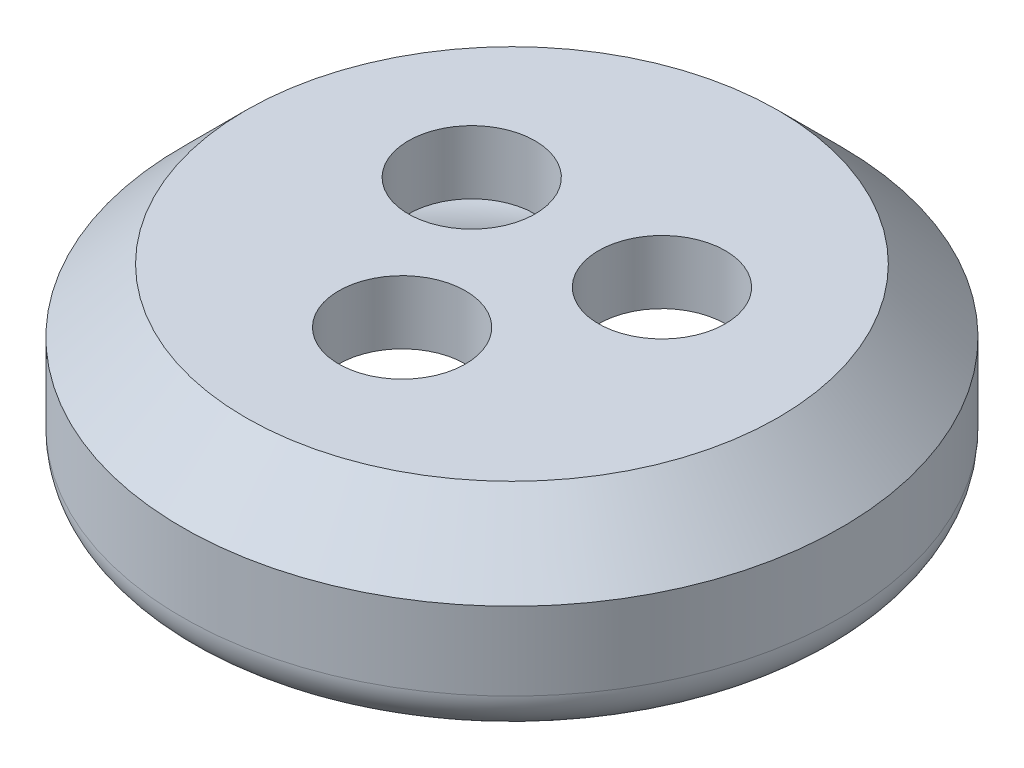
from build123d import *

# Parameters (mm, degrees)
CUT_EXTRUDE1_REACH = 24.772
SKETCH3_R          = 3


with BuildPart() as part:
    # Sketch2 → Revolve1 (revolve)
    with BuildSketch(Plane.XY, mode=Mode.PRIVATE) as revolve1_sk:
        with BuildLine():
            Line((-12.593114148, 22.177254176), (-15.593114148, 19.177254176))
            Line((-15.593114148, 19.177254176), (-15.593114148, 15.495111766))
            ThreePointArc((-15.593114148, 15.495111766), (-15.00732771, 14.080898204), (-13.593114148, 13.495111766))
            Line((-13.593114148, 13.495111766), (-12.565328021, 13.495111766))
            ThreePointArc((-12.565328021, 13.495111766), (-12.634939156, 14.785886966), (-13.41748538, 15.814754176))
            ThreePointArc((-13.41748538, 15.814754176), (-13.513613389, 15.897930793), (-13.593114148, 15.997120375))
            ThreePointArc((-13.593114148, 15.997120375), (-13.503619616, 17.46180735), (-12.915716215, 18.806309784))
            ThreePointArc((-12.915716215, 18.806309784), (-11.959555448, 19.80834635), (-10.624554433, 20.177254176))
            Line((-10.624554433, 20.177254176), (-9.75, 20.177254176))
            ThreePointArc((-9.75, 20.177254176), (-9.255025253, 19.972228922), (-9.05, 19.477254176))
            Line((-9.05, 19.477254176), (-9.05, 19.177254176))
            Line((-9.05, 19.177254176), (0, 19.177254176))
            Line((0, 19.177254176), (0, 22.177254176))
            Line((0, 22.177254176), (-12.593114148, 22.177254176))
        make_face()
    revolve(revolve1_sk.sketch.rotate(Axis((0, 0, 0), (0, 1, 0)), 270), axis=Axis((0, 0, 0), (0, 1, 0)))

    # Sketch3 → Cut-Extrude1 (cut, up to next)
    with BuildSketch(Plane.XZ.offset(-19.177254176), mode=Mode.PRIVATE) as cut_extrude1_sk1:
        with Locations(Location((-4.5, -2.598076211, 0), (0, 0, 270))):
            Circle(SKETCH3_R)
    cut_extrude1_tool1 = extrude(cut_extrude1_sk1.sketch, amount=-CUT_EXTRUDE1_REACH, mode=Mode.PRIVATE) & part.part
    # Sketch3 → Cut-Extrude1 (cut, up to next)
    with BuildSketch(Plane.XZ.offset(-19.177254176), mode=Mode.PRIVATE) as cut_extrude1_sk2:
        with Locations(Location((4.5, -2.598076211, 0), (0, 0, 270))):
            Circle(SKETCH3_R)
    cut_extrude1_tool2 = extrude(cut_extrude1_sk2.sketch, amount=-CUT_EXTRUDE1_REACH, mode=Mode.PRIVATE) & part.part
    # Sketch3 → Cut-Extrude1 (cut, up to next)
    with BuildSketch(Plane.XZ.offset(-19.177254176), mode=Mode.PRIVATE) as cut_extrude1_sk3:
        with Locations(Location((0, 5.196152423, 0), (0, 0, 270))):
            Circle(SKETCH3_R)
    cut_extrude1_tool3 = extrude(cut_extrude1_sk3.sketch, amount=-CUT_EXTRUDE1_REACH, mode=Mode.PRIVATE) & part.part
    add(cut_extrude1_tool1.solids().sort_by_distance((-4.5, 19.177254, -2.598076))[0], mode=Mode.SUBTRACT)
    add(cut_extrude1_tool2.solids().sort_by_distance((4.5, 19.177254, -2.598076))[0], mode=Mode.SUBTRACT)
    add(cut_extrude1_tool3.solids().sort_by_distance((0, 19.177254, 5.196152))[0], mode=Mode.SUBTRACT)


solid = part.part
